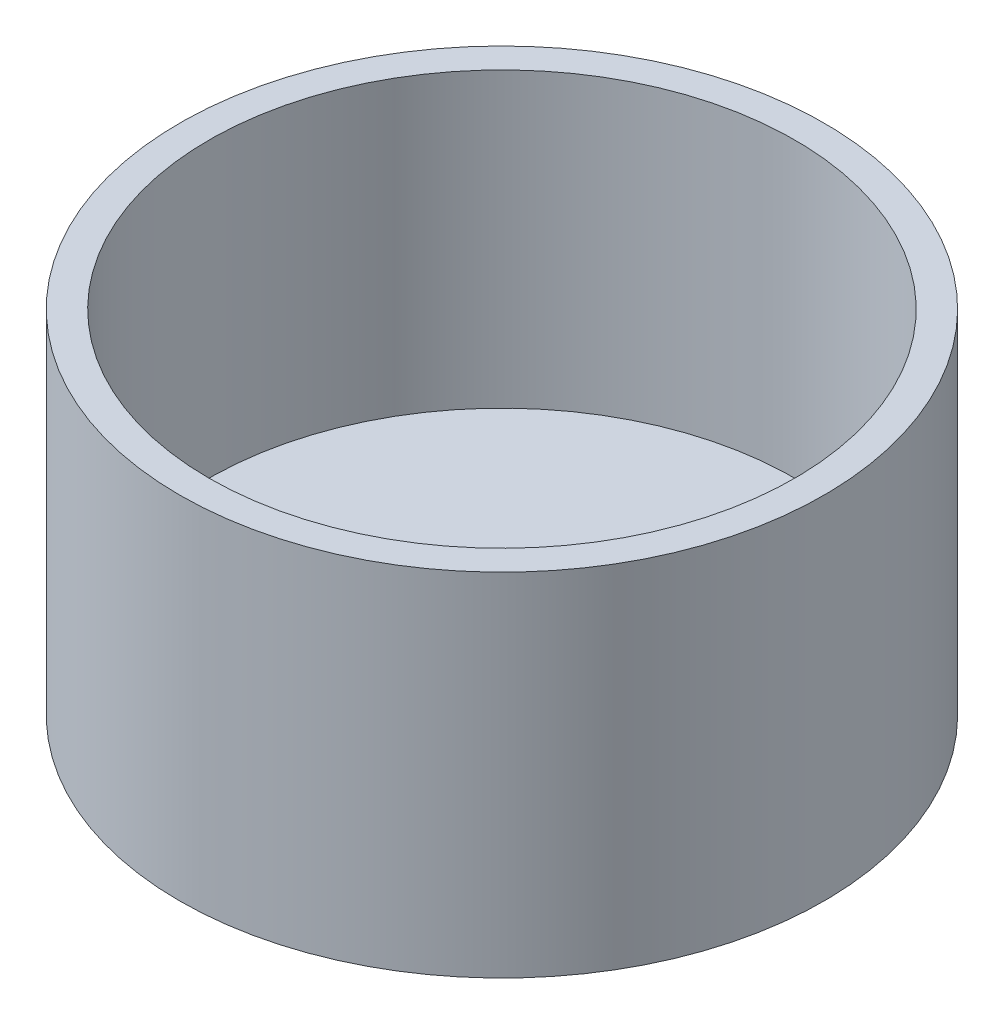
from build123d import *

# Parameters (mm, degrees)
SKETCH1_R           = 2.75
SKETCH1_R_2         = 0.75
BOSS_EXTRUDE1_DEPTH = 3
SKETCH4_R           = 2.5
CUT_EXTRUDE2_DEPTH  = 2.5


with BuildPart() as part:
    # Sketch1 → Boss-Extrude1 (new body)
    with BuildSketch(Plane(origin=(0, 0, 0), x_dir=(1, 0, 0), z_dir=(0, 1, 0))):
        with Locations(Location((0, 0, 0), (0, 0, 270))):
            Circle(SKETCH1_R)
        with Locations(Location((0, 0, 0), (0, 0, 270))):
            Circle(SKETCH1_R_2, mode=Mode.SUBTRACT)
    extrude(amount=BOSS_EXTRUDE1_DEPTH)

    # Sketch4 → Cut-Extrude2 (cut)
    with BuildSketch(Plane(origin=(0, 3, 0), x_dir=(1, 0, 0), z_dir=(0, 1, 0))):
        with Locations(Location((0, 0, 0), (0, 0, 270))):
            Circle(SKETCH4_R)
    extrude(amount=-CUT_EXTRUDE2_DEPTH, mode=Mode.SUBTRACT)


solid = part.part
